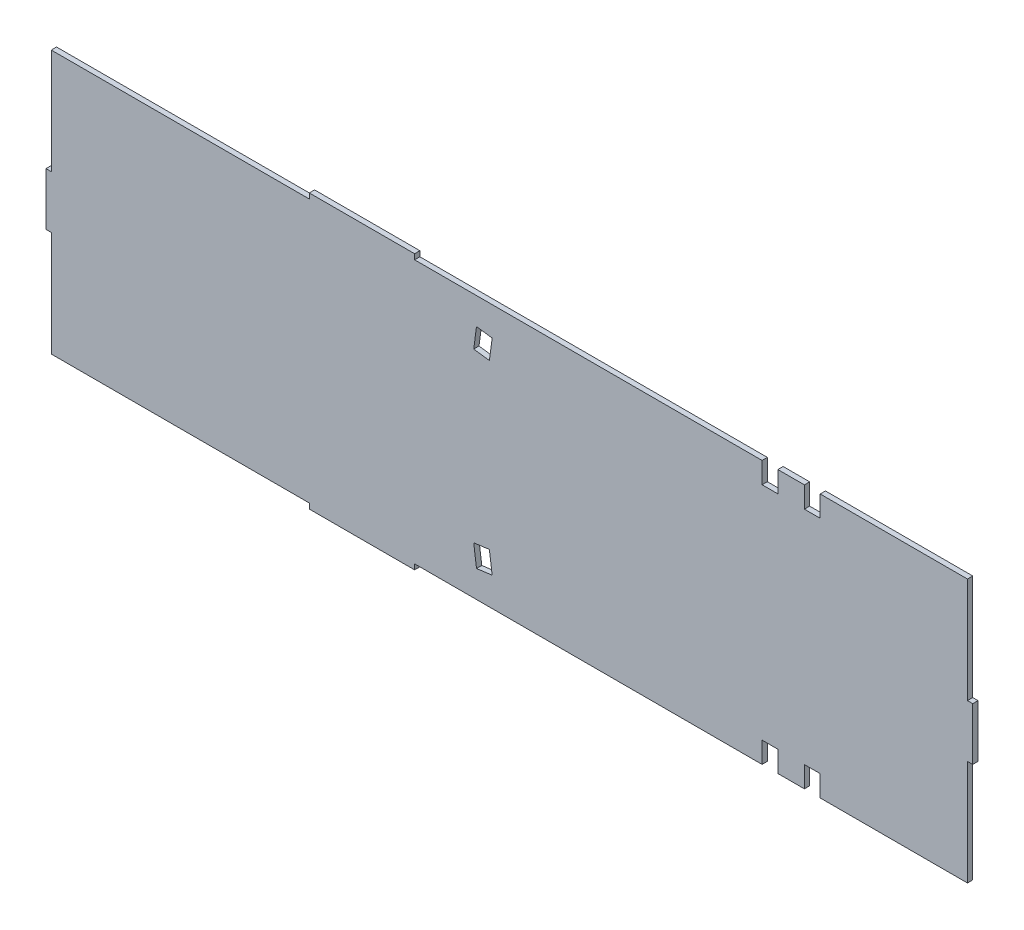
from build123d import *

# Parameters (mm, degrees)
SKETCH_1_W          = 2
SKETCH_1_H          = 20
SKETCH_1_W_2        = 40
SKETCH_1_H_2        = 2
EXTRUDE_1_DEPTH     = 2
CUT_EXTRUDE_1_DEPTH = 10
SKETCH_3_W          = 6
SKETCH_3_H          = 8
CUT_EXTRUDE_2_DEPTH = 2
SKETCH_4_W          = 6
SKETCH_4_H          = 8
CUT_EXTRUDE_3_DEPTH = 2


with BuildPart() as part:
    # 草图1 → 凸台-拉伸1 (new body)
    with BuildSketch(Plane.XY):
        with Locations((1, 50)):
            Rectangle(SKETCH_1_W, SKETCH_1_H)
        Polygon((2, 40), (2, 0), (100, 0), (140, 0), (350, 0), (350, 40), (350, 60), (350, 100), (140, 100), (100, 100), (2, 100), (2, 60), align=None)
        with Locations((120, 101)):
            Rectangle(SKETCH_1_W_2, SKETCH_1_H_2)
        with Locations((120, -1)):
            Rectangle(SKETCH_1_W_2, SKETCH_1_H_2)
        with Locations((351, 50)):
            Rectangle(SKETCH_1_W, SKETCH_1_H)
    extrude(amount=EXTRUDE_1_DEPTH)

    # 草图2 → 切除-拉伸1 (cut)
    with BuildSketch(Plane(origin=(0, 0, 0), x_dir=(-1, 0, 0), z_dir=(0, 0, -1))):
        Polygon((-168.407456688, 81.069541445), (-169.466891791, 88.999080981), (-163.519737138, 89.793657309), (-162.460302035, 81.864117772), align=None)
        Polygon((-162.460302035, 18.135882228), (-168.407456688, 18.930458555), (-169.466891791, 11.000919019), (-163.519737138, 10.206342691), align=None)
    extrude(amount=-CUT_EXTRUDE_1_DEPTH, mode=Mode.SUBTRACT)

    # 草图3 → 切除-拉伸2 (cut)
    with BuildSketch(Plane.XY.offset(2)):
        with Locations((291.061030213, 96)):
            Rectangle(SKETCH_3_W, SKETCH_3_H)
        with Locations((291.061030213, 4)):
            Rectangle(SKETCH_3_W, SKETCH_3_H)
    extrude(amount=-CUT_EXTRUDE_2_DEPTH, mode=Mode.SUBTRACT)

    # 草图4 → 切除-拉伸3 (cut)
    with BuildSketch(Plane.XY.offset(2)):
        with Locations((274.986515691, 4)):
            Rectangle(SKETCH_4_W, SKETCH_4_H)
        with Locations((274.986515691, 96)):
            Rectangle(SKETCH_4_W, SKETCH_4_H)
    extrude(amount=-CUT_EXTRUDE_3_DEPTH, mode=Mode.SUBTRACT)


solid = part.part
